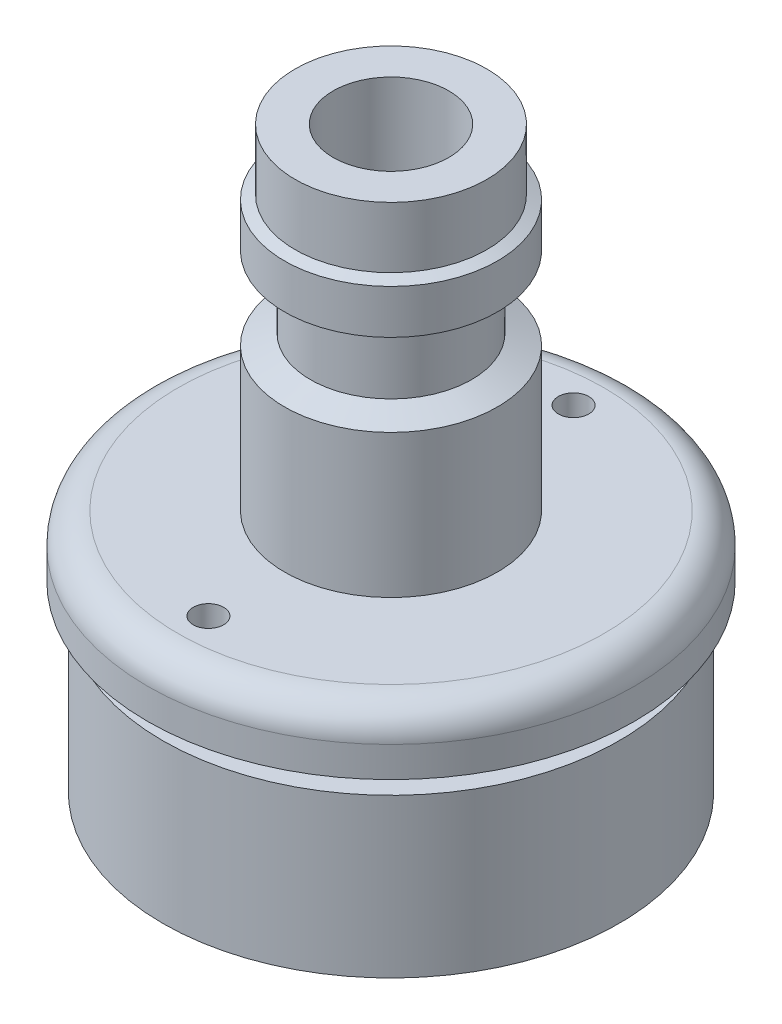
from build123d import *

# Parameters (mm, degrees)
SKETCH1_R           = 9.525
SHAFT_DEPTH         = 7.62
SKETCH11_R          = 9.779
SKETCH11_R_2        = 8.509
THREAD_RECESS_DEPTH = 1.016
SKETCH13_R          = 7.1374
LARGE_HOLE_DEPTH    = 22.88678373
SKETCH14_R          = 2.413
SMALL_HOLE_DEPTH    = 22.88678373
CHAMFER1_SIZE       = 1.778
SKETCH15_R          = 0.635
TOOL_HOLES_DEPTH    = 1.524


with BuildPart() as part:
    # Sketch1 → Shaft (new body)
    with BuildSketch(Plane(origin=(0, 0, 0), x_dir=(1, 0, 0), z_dir=(0, 1, 0))):
        Circle(SKETCH1_R)
    extrude(amount=-SHAFT_DEPTH)

    # Sketch11 → Thread Recess (cut)
    with BuildSketch(Plane(origin=(0, 0, 0), x_dir=(1, 0, 0), z_dir=(0, 1, 0))):
        Circle(SKETCH11_R)
        Circle(SKETCH11_R_2, mode=Mode.SUBTRACT)
    extrude(amount=-THREAD_RECESS_DEPTH, mode=Mode.SUBTRACT)

    # Sketch12 → Standard Connector (revolve)
    with BuildSketch(Plane.XY):
        with BuildLine():
            Line((0, 0), (10.16, 0))
            Line((10.16, 0), (10.16, 1.27))
            ThreePointArc((10.16, 1.27), (9.788025612, 2.168025612), (8.89, 2.54))
            Line((8.89, 2.54), (4.445, 2.54))
            Line((4.445, 2.54), (4.445, 8.509))
            Line((4.445, 8.509), (3.3655, 8.956143541))
            Line((3.3655, 8.956143541), (3.3655, 11.496143541))
            Line((3.3655, 11.496143541), (4.445, 11.943287081))
            Line((4.445, 11.943287081), (4.445, 13.785882072))
            Line((4.445, 13.785882072), (4.0005, 13.97))
            Line((4.0005, 13.97), (4.0005, 16.51))
            Line((4.0005, 16.51), (0, 16.51))
            Line((0, 16.51), (0, 0))
        make_face()
    revolve(axis=Axis((0, 0, 0), (0, 1, 0)))

    # Sketch13 → Large Hole (cut, through all)
    with BuildSketch(Plane(origin=(0, 0, 0), x_dir=(1, 0, 0), z_dir=(0, 1, 0))):
        Circle(SKETCH13_R)
    extrude(amount=-LARGE_HOLE_DEPTH, mode=Mode.SUBTRACT)

    # Sketch14 → Small Hole (cut, through all)
    with BuildSketch(Plane(origin=(0, 0, 0), x_dir=(1, 0, 0), z_dir=(0, 1, 0))):
        Circle(SKETCH14_R)
    extrude(amount=SMALL_HOLE_DEPTH, mode=Mode.SUBTRACT)

    # Chamfer1
    chamfer1_edges = [part.edges().sort_by_distance(p)[0] for p in [
        (-2.413, 0, 0),
    ]]
    chamfer(chamfer1_edges, length=CHAMFER1_SIZE)

    # Sketch15 → Tool Holes (cut)
    with BuildSketch(Plane(origin=(0, 2.54, 0), x_dir=(-1, 0, 0), z_dir=(0, 1, 0))):
        with Locations((0, -7.62)):
            Circle(SKETCH15_R)
        with Locations((0, 7.62)):
            Circle(SKETCH15_R)
    extrude(amount=-TOOL_HOLES_DEPTH, mode=Mode.SUBTRACT)


solid = part.part
